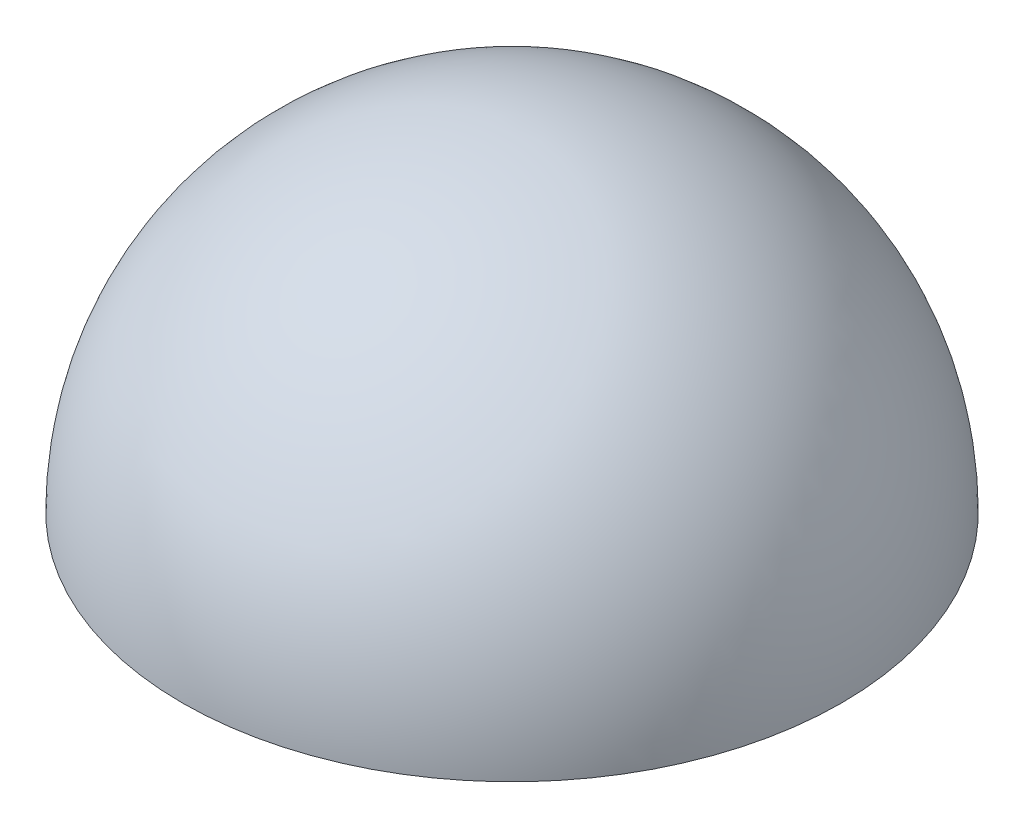
from build123d import *


with BuildPart() as part:
    # Sketch1 → Revolve1 (revolve)
    with BuildSketch(Plane(origin=(0, 0, 0), x_dir=(0, 0, -1), z_dir=(1, 0, 0))):
        with BuildLine():
            Line((0, 0), (0, 12.7))
            ThreePointArc((0, 12.7), (-8.980256121, 8.980256121), (-12.7, 0))
            Line((-12.7, 0), (0, 0))
        make_face()
    revolve(axis=Axis((0, 0, 0), (0, 1, 0)))


solid = part.part
